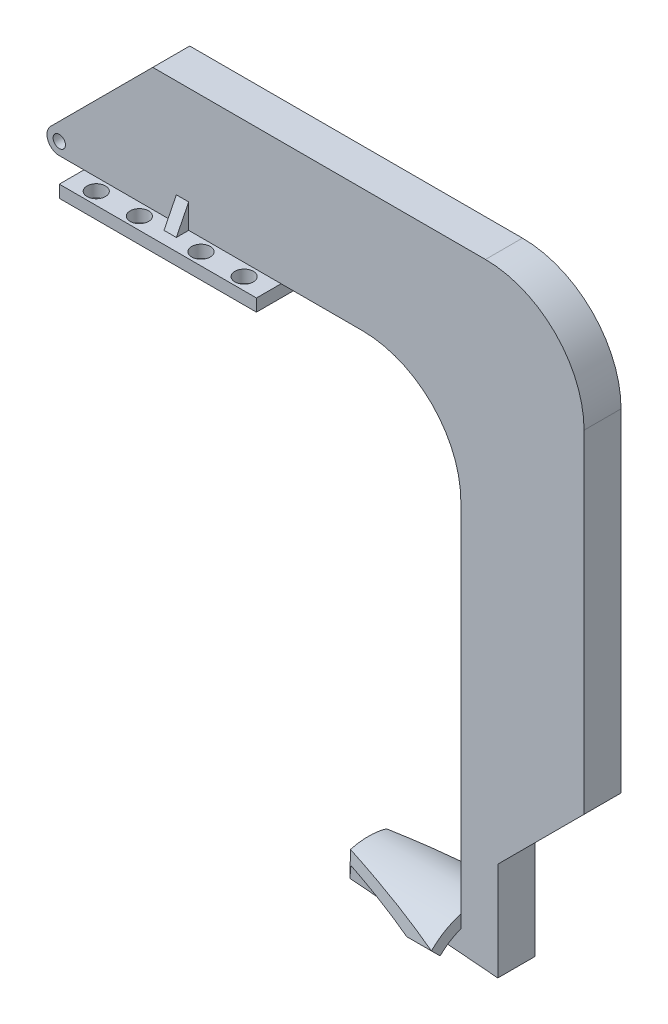
from build123d import *

# Parameters (mm, degrees)
SKETCH1_R           = 5
BOSS_EXTRUDE1_DEPTH = 30
SKETCH2_W           = 160
SKETCH2_H           = 20
SKETCH2_H_2         = 30
BOSS_EXTRUDE2_DEPTH = 10
RIB1_REACH          = 528.102
SKETCH5_WALL_W      = 1076.564743208
SKETCH5_WALL_H      = 10
RIB17_REACH         = 528.102
SKETCH7_WALL_W      = 1076.564743208
SKETCH7_WALL_H      = 10
SKETCH8_R           = 7.5
CUT_EXTRUDE1_DEPTH  = 10
BOSS_EXTRUDE3_DEPTH = 90
CUT_EXTRUDE3_DEPTH  = 30


with BuildPart() as part:
    # Sketch1 → Boss-Extrude1 (new body)
    with BuildSketch(Plane.XY):
        with BuildLine():
            Line((-7.071067812, 7.071067812), (75.857864376, 90))
            Line((75.857864376, 90), (345.857864376, 90))
            ThreePointArc((345.857864376, 90), (402.426406871, 66.568542495), (425.857864376, 10))
            Line((425.857864376, 10), (425.857864376, -260))
            Line((425.857864376, -260), (355.857864376, -330))
            Line((355.857864376, -330), (355.857864376, -410))
            Line((355.857864376, -410), (235.857864376, -400))
            Line((235.857864376, -400), (235.857864376, -380))
            Line((235.857864376, -380), (325.857864376, -380))
            Line((325.857864376, -380), (325.857864376, -90))
            ThreePointArc((325.857864376, -90), (302.426406871, -33.431457505), (245.857864376, -10))
            Line((245.857864376, -10), (0, -10))
            ThreePointArc((0, -10), (-9.238795325, -3.826834324), (-7.071067812, 7.071067812))
        make_face()
        Circle(SKETCH1_R, mode=Mode.SUBTRACT)
    extrude(amount=BOSS_EXTRUDE1_DEPTH)

    # Sketch2 → Boss-Extrude2 (add)
    with BuildSketch(Plane.XZ.offset(10)):
        with Locations((100, 40)):
            Rectangle(SKETCH2_W, SKETCH2_H)
        with Locations((100, 15)):
            Rectangle(SKETCH2_W, SKETCH2_H_2)
        with Locations((100, -10)):
            Rectangle(SKETCH2_W, SKETCH2_H)
    extrude(amount=BOSS_EXTRUDE2_DEPTH)

    # Sketch5 wall → Rib1 (add, up to next)
    with BuildSketch(Plane(origin=(100, 0, 35), x_dir=(0, -0.894427191, 0.4472135955), z_dir=(0, 0.4472135955, 0.894427191)), mode=Mode.PRIVATE) as rib1_sk1:
        Rectangle(SKETCH5_WALL_W, SKETCH5_WALL_H)
    rib1_tool1 = extrude(rib1_sk1.sketch, amount=-RIB1_REACH, mode=Mode.PRIVATE) - part.part
    add(rib1_tool1.solids().sort_by_distance((100, 0, 35))[0])

    # Sketch7 wall → Rib17 (add, up to next)
    with BuildSketch(Plane(origin=(100, 0, -5), x_dir=(0, -0.894427191, -0.4472135955), z_dir=(0, -0.4472135955, 0.894427191)), mode=Mode.PRIVATE) as rib17_sk1:
        Rectangle(SKETCH7_WALL_W, SKETCH7_WALL_H)
    rib17_tool1 = extrude(rib17_sk1.sketch, amount=RIB17_REACH, mode=Mode.PRIVATE) - part.part
    add(rib17_tool1.solids().sort_by_distance((100, 0, -5))[0])

    # Sketch8 → Cut-Extrude1 (cut)
    with BuildSketch(Plane.XZ.offset(20)):
        with Locations((40, 40)):
            Circle(SKETCH8_R)
        with Locations((75, 40)):
            Circle(SKETCH8_R)
        with Locations((40, -10)):
            Circle(SKETCH8_R)
        with Locations((75, -10)):
            Circle(SKETCH8_R)
        with Locations((125, -10)):
            Circle(SKETCH8_R)
        with Locations((160, -10)):
            Circle(SKETCH8_R)
        with Locations((160, 40)):
            Circle(SKETCH8_R)
        with Locations((125, 40)):
            Circle(SKETCH8_R)
    extrude(amount=-CUT_EXTRUDE1_DEPTH, mode=Mode.SUBTRACT)

    # Sketch9 → Boss-Extrude3 (add)
    with BuildSketch(Plane.ZY.offset(-325.857864376)):
        with BuildLine():
            Line((-23.890872965, -394.024153256), (-16.819805153, -401.095221068))
            ThreePointArc((-16.819805153, -401.095221068), (15, -387.915026221), (46.819805153, -401.095221068))
            Line((46.819805153, -401.095221068), (53.890872965, -394.024153256))
            ThreePointArc((53.890872965, -394.024153256), (15, -377.915026221), (-23.890872965, -394.024153256))
        make_face()
    extrude(amount=BOSS_EXTRUDE3_DEPTH)

    # Sketch10 → Cut-Extrude3 (cut)
    with BuildSketch(Plane(origin=(-31.476842315, -377.722107776, 0), x_dir=(0.9965457582448797, -0.08304547985374007, 0), z_dir=(-0.08304547985374007, -0.9965457582448797, 0))):
        Polygon((374.546486812, 58.469151485), (256.226012344, 26.776259204), (256.226012344, 62.056204403), align=None)
        Polygon((374.082224106, -28.344795763), (258.075215741, 2.728419895), (258.075215741, -32.721264486), align=None)
    extrude(amount=-CUT_EXTRUDE3_DEPTH, mode=Mode.SUBTRACT)


with BuildPart() as body_2:
    # of the pieces the cut leaves, the one that is kept (cut_extrude3_keep)
    add(part.part.solids().sort_by_distance((245.857864376, -10, 0))[0])


solid = body_2.part
